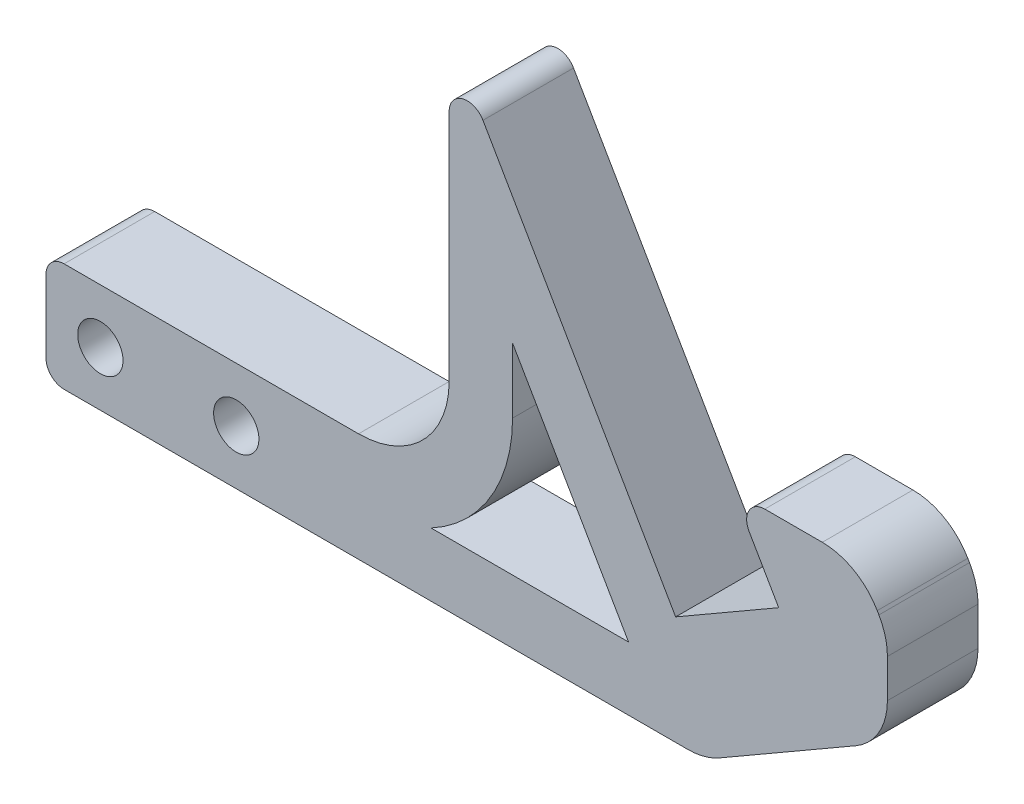
from build123d import *

# Parameters (mm, degrees)
SKETCH1_R           = 2.5
BOSS_EXTRUDE1_DEPTH = 10


with BuildPart() as part:
    # Sketch1 → Boss-Extrude1 (new body)
    with BuildSketch(Plane.XY):
        with BuildLine():
            Line((-11.526582654, 6), (20.973417346, 6))
            ThreePointArc((20.973417346, 6), (28.044485158, 8.928932188), (30.973417346, 16))
            Line((30.973417346, 16), (30.973417346, 41.837168574))
            ThreePointArc((30.973417346, 41.837168574), (32.455779256, 43.769020227), (34.705468153, 42.837168574))
            Line((34.705468153, 42.837168574), (55.973417346, 6))
            Line((55.973417346, 6), (67.348943548, 12.567663115))
            Line((67.348943548, 12.567663115), (64.080994355, 18.227917153))
            ThreePointArc((64.080994355, 18.227917153), (64.080994355, 20.227917153), (65.813045163, 21.227917153))
            Line((65.813045163, 21.227917153), (72.163898124, 21.227917153))
            ThreePointArc((72.163898124, 21.227917153), (75.663898124, 20.290094979), (78.22607595, 17.727917153))
            Line((78.22607595, 17.727917153), (78.411121374, 17.407409077))
            ThreePointArc((78.411121374, 17.407409077), (79.110424332, 15.719142393), (79.348943548, 13.907409077))
            Line((79.348943548, 13.907409077), (79.348943548, 9.680911769))
            ThreePointArc((79.348943548, 9.680911769), (78.411121374, 6.180911769), (75.848943548, 3.618733942))
            Line((75.848943548, 3.618733942), (60.813163308, -5.062177826))
            ThreePointArc((60.813163308, -5.062177826), (59.124896624, -5.761480784), (57.313163308, -6))
            Line((57.313163308, -6), (-11.526582654, -6))
            ThreePointArc((-11.526582654, -6), (-12.940796217, -5.414213562), (-13.526582654, -4))
            Line((-13.526582654, -4), (-13.526582654, 4))
            ThreePointArc((-13.526582654, 4), (-12.940796217, 5.414213562), (-11.526582654, 6))
        make_face()
        with Locations((-7.526582654, 0)):
            Circle(SKETCH1_R, mode=Mode.SUBTRACT)
        with Locations((7.473417346, 0)):
            Circle(SKETCH1_R, mode=Mode.SUBTRACT)
        with BuildLine():
            Line((50.777264923, 1), (28.973417346, 1))
            ThreePointArc((28.973417346, 1), (35.550797083, 7.253572158), (37.973417346, 16))
            Line((37.973417346, 16), (37.973417346, 23.176914536))
            Line((37.973417346, 23.176914536), (50.777264923, 1))
        make_face(mode=Mode.SUBTRACT)
    extrude(amount=BOSS_EXTRUDE1_DEPTH)


solid = part.part
